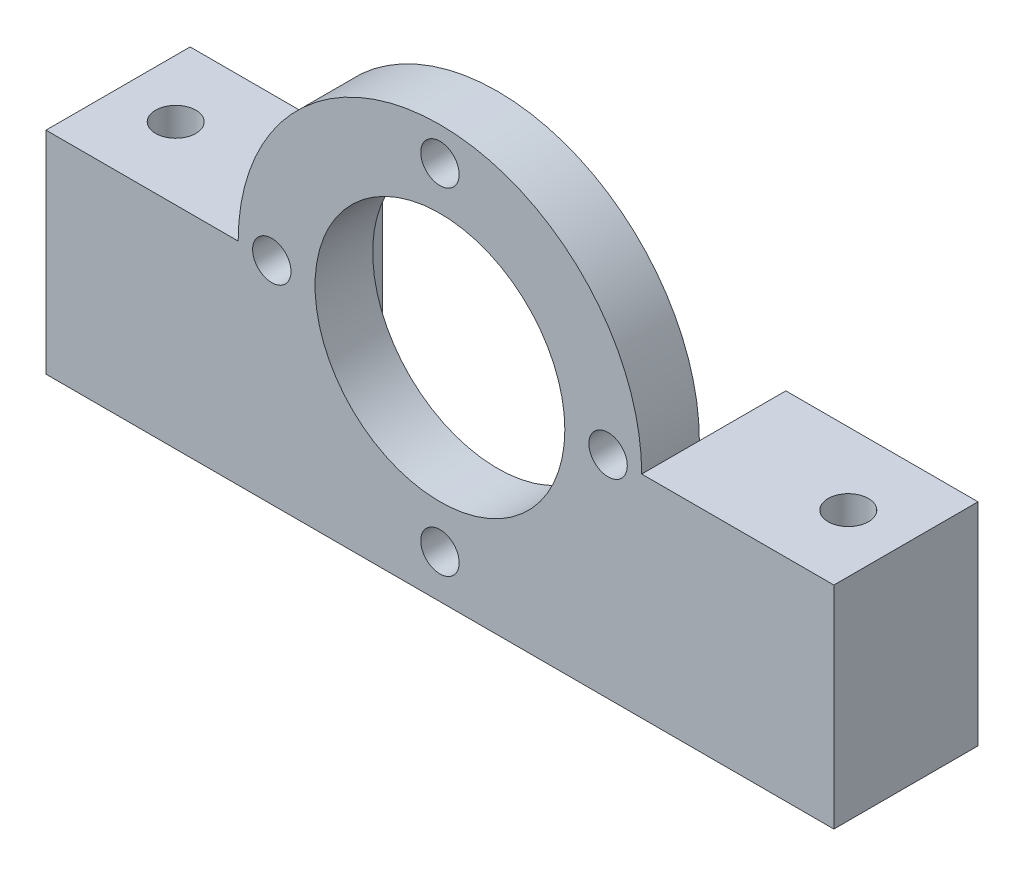
from build123d import *

# Parameters (mm, degrees)
SKETCH_1_R          = 13
SKETCH_1_R_2        = 2
EXTRUDE_1_DEPTH     = 6
SKETCH_2_W          = 20
SKETCH_2_H          = 22
EXTRUDE_2_DEPTH     = 15
SKETCH_3_R          = 2.1
CUT_EXTRUDE_1_DEPTH = 48.391982444


with BuildPart() as part:
    # 草图1 → 凸台-拉伸1 (new body)
    with BuildSketch(Plane.XY):
        with BuildLine():
            Line((-21, 22), (-21, 0))
            Line((-21, 0), (21, 0))
            Line((21, 0), (21, 22))
            ThreePointArc((21, 22), (0, 43), (-21, 22))
        make_face()
        with Locations((0, 22)):
            Circle(SKETCH_1_R, mode=Mode.SUBTRACT)
        with Locations((0, 39.5)):
            Circle(SKETCH_1_R_2, mode=Mode.SUBTRACT)
        with Locations((17.5, 22)):
            Circle(SKETCH_1_R_2, mode=Mode.SUBTRACT)
        with Locations((0, 4.5)):
            Circle(SKETCH_1_R_2, mode=Mode.SUBTRACT)
        with Locations((-17.5, 22)):
            Circle(SKETCH_1_R_2, mode=Mode.SUBTRACT)
    extrude(amount=EXTRUDE_1_DEPTH)

    # 草图2 → 凸台-拉伸2 (add)
    with BuildSketch(Plane.XY.offset(6)):
        with Locations((-31, 11)):
            Rectangle(SKETCH_2_W, SKETCH_2_H)
        with Locations((31, 11)):
            Rectangle(SKETCH_2_W, SKETCH_2_H)
    extrude(amount=-EXTRUDE_2_DEPTH)

    # 草图3 → 切除-拉伸1 (cut, through all)
    with BuildSketch(Plane(origin=(0, 22, 0), x_dir=(1, 0, 0), z_dir=(0, 1, 0))):
        with Locations(Location((-35, 1.5, 0), (0, 0, 180))):
            Circle(SKETCH_3_R)
        with Locations((35, 1.5)):
            Circle(SKETCH_3_R)
    extrude(amount=-CUT_EXTRUDE_1_DEPTH, mode=Mode.SUBTRACT)


solid = part.part
